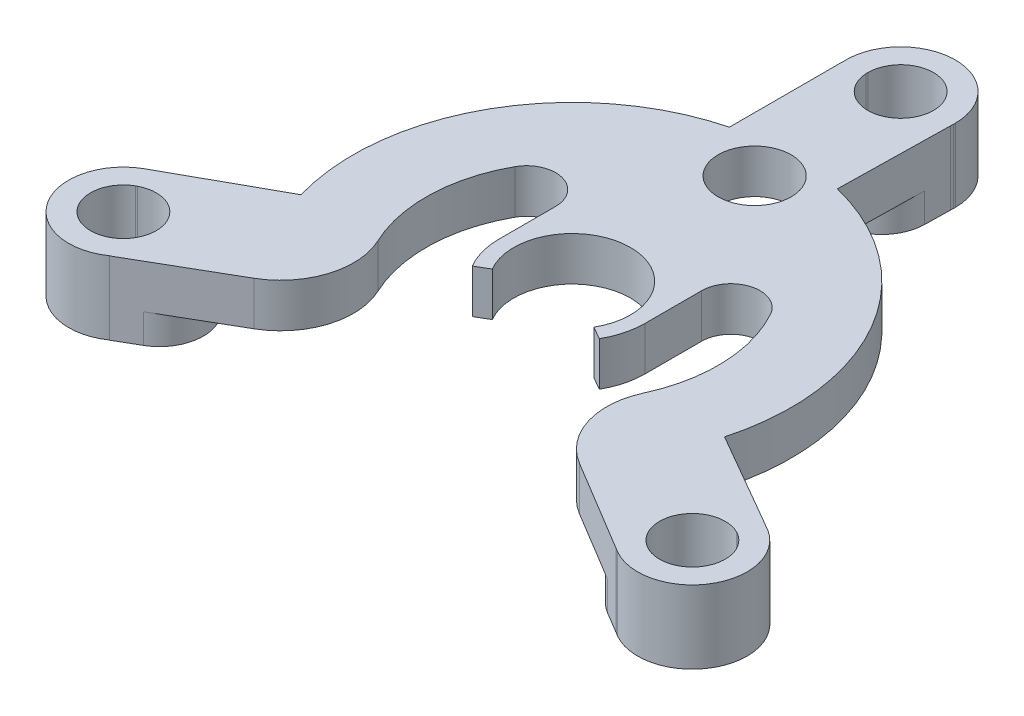
from build123d import *
from build123d.topology import SkipClean

# Parameters (mm, degrees)
EXTRUDE_1_DEPTH     = 5
SKETCH_2_R          = 17.5
CUT_EXTRUDE_1_DEPTH = 2
FILLET_1_R          = 3
EXTRUDE_2_DEPTH     = 3
SKETCH_4_R          = 10
CUT_EXTRUDE_2_DEPTH = 3
FILLET_2_R          = 5
EXTRUDE_3_DEPTH     = 3
FILLET_3_R          = 2
SKETCH_6_R          = 2.5
CUT_EXTRUDE_3_DEPTH = 3


with BuildPart() as part:
    # 草图1 → 凸台-拉伸1 (new body)
    with BuildSketch(Plane(origin=(0, 0, 0), x_dir=(1, 0, 0), z_dir=(0, 1, 0))):
        with BuildLine():
            Line((-17.338032686, -14.340244858), (0.36317955, -4.120445208))
            Line((0.36317955, -4.120445208), (17.341691759, -14.335819716))
            ThreePointArc((17.341691759, -14.335819716), (17.344076322, -14.33293468), (17.346460405, -14.330049246))
            ThreePointArc((17.346460405, -14.330049246), (17.419960834, -14.379816644), (17.494618607, -14.42783043))
            Line((17.494618607, -14.42783043), (17.610571585, -14.497595264))
            ThreePointArc((17.610571585, -14.497595264), (22.80853464, -12.987934561), (21.083416888, -7.857450754))
            ThreePointArc((21.083416888, -7.857450754), (21.085725698, -7.851252881), (21.088032686, -7.845054329))
            Line((21.088032686, -7.845054329), (3.38682045, 2.374745321))
            Line((3.38682045, 2.374745321), (3.744338179, 22.186255466))
            ThreePointArc((3.744338179, 22.186255466), (3.740647382, 22.18687804), (3.736956482, 22.1875))
            ThreePointArc((3.736956482, 22.1875), (3.743306098, 22.276036937), (3.74755837, 22.364699358))
            Line((3.74755837, 22.364699358), (3.75, 22.5))
            ThreePointArc((3.75, 22.5), (-0.156386047, 26.246737702), (-3.736956482, 22.1875))
            ThreePointArc((-3.736956482, 22.1875), (-3.743478403, 22.186400552), (-3.75, 22.185299187))
            Line((-3.75, 22.185299187), (-3.75, 1.745699887))
            Line((-3.75, 1.745699887), (-21.086029938, -7.85043575))
            ThreePointArc((-21.086029938, -7.85043575), (-21.084723704, -7.85394336), (-21.083416888, -7.857450754))
            ThreePointArc((-21.083416888, -7.857450754), (-21.163266932, -7.896220293), (-21.242176977, -7.936868928))
            Line((-21.242176977, -7.936868928), (-21.360571585, -8.002404736))
            ThreePointArc((-21.360571585, -8.002404736), (-22.652148592, -13.258803141), (-17.346460405, -14.330049246))
            ThreePointArc((-17.346460405, -14.330049246), (-17.342247295, -14.335147671), (-17.338032686, -14.340244858))
        make_face()
        with BuildLine():
            ThreePointArc((-18.264550857, -13.139869938), (-18.263724931, -13.141017908), (-18.262898932, -13.142165826))
            Line((-18.262898932, -13.142165826), (-18.360571585, -13.198557159))
            ThreePointArc((-18.360571585, -13.198557159), (-21.434128744, -12.375), (-20.610571585, -9.301442841))
            Line((-20.610571585, -9.301442841), (-20.512898932, -9.245051509))
            ThreePointArc((-20.512898932, -9.245051509), (-20.512317805, -9.246340804), (-20.511736597, -9.247630062))
            ThreePointArc((-20.511736597, -9.247630062), (-17.537014427, -10.125), (-18.264550857, -13.139869938))
        make_face(mode=Mode.SUBTRACT)
        with BuildLine():
            ThreePointArc((20.511736597, -9.247630062), (20.512317805, -9.246340804), (20.512898932, -9.245051509))
            Line((20.512898932, -9.245051509), (20.610571585, -9.301442841))
            ThreePointArc((20.610571585, -9.301442841), (21.434128744, -12.375), (18.360571585, -13.198557159))
            Line((18.360571585, -13.198557159), (18.262898932, -13.142165826))
            ThreePointArc((18.262898932, -13.142165826), (18.263724931, -13.141017908), (18.264550857, -13.139869938))
            ThreePointArc((18.264550857, -13.139869938), (17.537014427, -10.125), (20.511736597, -9.247630062))
        make_face(mode=Mode.SUBTRACT)
        with BuildLine():
            Line((-2.25, 22.387217335), (-2.25, 22.5))
            ThreePointArc((-2.25, 22.5), (0, 24.75), (2.25, 22.5))
            Line((2.25, 22.5), (2.25, 22.387217335))
            ThreePointArc((2.25, 22.387217335), (2.248592874, 22.387358712), (2.24718574, 22.3875))
            ThreePointArc((2.24718574, 22.3875), (0, 20.25), (-2.24718574, 22.3875))
            ThreePointArc((-2.24718574, 22.3875), (-2.248592874, 22.387358712), (-2.25, 22.387217335))
        make_face(mode=Mode.SUBTRACT)
    extrude(amount=EXTRUDE_1_DEPTH)

    # 草图2 → 切除-拉伸1 (cut)
    with BuildSketch(Plane.XZ):
        Circle(SKETCH_2_R)
    extrude(amount=-CUT_EXTRUDE_1_DEPTH, mode=Mode.SUBTRACT)

    # 圆角1
    fillet_1_edges = [part.edges().sort_by_distance(p)[0] for p in [
        (-12.928399103, 1, 11.794341721),
        (12.995206069, 1, 11.720691926),
        (16.678399103, 1, 5.299151193),
        (3.652813923, 1, -17.114524546),
        (-3.75, 1, -17.093492914),
        (-16.648019992, 1, 5.393832621),
    ]]
    fillet(fillet_1_edges, radius=FILLET_1_R)

    # 草图3 → 凸台-拉伸2 (add)
    with BuildSketch(Plane(origin=(0, 5, 0), x_dir=(1, 0, 0), z_dir=(0, 1, 0))):
        with BuildLine():
            Line((9.903270362, -1.38752879), (14.452882373, -4.01424851))
            ThreePointArc((14.452882373, -4.01424851), (14.862591221, -2.025680676), (15, 0))
            ThreePointArc((15, 0), (11.813143266, 9.24389778), (3.606713844, 14.559931842))
            Line((3.606713844, 14.559931842), (3.512924046, 9.362657991))
            ThreePointArc((3.512924046, 9.362657991), (8.219770084, 5.695206737), (10, 0))
            ThreePointArc((10, 0), (9.97578828, -0.695448195), (9.903270362, -1.38752879))
        make_face()
        with BuildLine():
            ThreePointArc((-3.75, 14.523687548), (-13.027173179, 7.435910097), (-14.412627775, -4.156460108))
            Line((-14.412627775, -4.156460108), (-9.86476169, -1.63904753))
            ThreePointArc((-9.86476169, -1.63904753), (-8.723165526, 4.889415425), (-3.75, 9.270248109))
            Line((-3.75, 9.270248109), (-3.75, 14.523687548))
        make_face()
    extrude(amount=-EXTRUDE_2_DEPTH)

    # 草图4 → 切除-拉伸2 (cut)
    with SkipClean():  # the faces are left unmerged after this step: merging them gives an invalid solid
        with BuildSketch(Plane(origin=(0, 5, 0), x_dir=(1, 0, 0), z_dir=(0, 1, 0))):
            Circle(SKETCH_4_R)
        extrude(amount=-CUT_EXTRUDE_2_DEPTH, mode=Mode.SUBTRACT)

    # 圆角2
    fillet_2_edges = [part.edges().sort_by_distance(p)[0] for p in [
        (-6.153270362, 3.5, 7.882719319),
        (6.351837644, 3.5, 7.72361046),
    ]]
    fillet(fillet_2_edges, radius=FILLET_2_R)

    # 草图5 → 凸台-拉伸3 (add)
    with SkipClean():  # the faces are left unmerged after this step: merging them gives an invalid solid
        with BuildSketch(Plane(origin=(0, 5, 0), x_dir=(1, 0, 0), z_dir=(0, 1, 0))):
            with BuildLine():
                Line((-4.318593576, -2.519870934), (-3.454874861, -2.015896748))
                ThreePointArc((-3.454874861, -2.015896748), (-3.861314507, -1.044150506), (-4, 0))
                Line((-4, 0), (-4, 3))
                ThreePointArc((-4, 3), (-4.74341649, 1.58113883), (-5, 0))
                ThreePointArc((-5, 0), (-4.826643134, -1.305188132), (-4.318593576, -2.519870934))
            make_face()
            with BuildLine():
                ThreePointArc((-5, 0), (-4.74341649, 1.58113883), (-4, 3))
                Line((-4, 3), (-4, 9.16515139))
                ThreePointArc((-4, 9.16515139), (-4.507075586, 8.926716623), (-5, 8.660254038))
                Line((-5, 8.660254038), (-5, 0))
            make_face()
            with BuildLine():
                ThreePointArc((-4, 3), (-2.246337039, 4.46698667), (-0.022975456, 4.999947213))
                Line((-0.022975456, 4.999947213), (-0.045950911, 9.999894425))
                ThreePointArc((-0.045950911, 9.999894425), (-2.065581922, 9.784343173), (-4, 9.16515139))
                Line((-4, 9.16515139), (-4, 3))
            make_face()
            with BuildLine():
                ThreePointArc((-4, 0), (-2.834918117, 2.821921202), (-0.018380364, 3.99995777))
                Line((-0.018380364, 3.99995777), (-0.022975456, 4.999947213))
                ThreePointArc((-0.022975456, 4.999947213), (-2.246337039, 4.46698667), (-4, 3))
                Line((-4, 3), (-4, 0))
            make_face()
            with BuildLine():
                Line((-0.045950911, 9.999894425), (-0.022975456, 4.999947213))
                ThreePointArc((-0.022975456, 4.999947213), (2.225787112, 4.477261633), (4, 3))
                Line((4, 3), (4, 9.16515139))
                ThreePointArc((4, 9.16515139), (2.020600167, 9.793731412), (-0.045950911, 9.999894425))
            make_face()
            with BuildLine():
                Line((-0.022975456, 4.999947213), (-0.018380364, 3.99995777))
                ThreePointArc((-0.018380364, 3.99995777), (2.821921202, 2.834918117), (4, 0))
                Line((4, 0), (4, 3))
                ThreePointArc((4, 3), (2.225787112, 4.477261633), (-0.022975456, 4.999947213))
            make_face()
            with BuildLine():
                Line((4, 9.16515139), (4, 3))
                ThreePointArc((4, 3), (4.74341649, 1.58113883), (5, 0))
                Line((5, 0), (5, 8.660254038))
                ThreePointArc((5, 8.660254038), (4.507075586, 8.926716623), (4, 9.16515139))
            make_face()
            with BuildLine():
                ThreePointArc((4, 0), (3.866071708, -1.02639639), (3.473255225, -1.984061023))
                Line((3.473255225, -1.984061023), (4.341569031, -2.480076278))
                ThreePointArc((4.341569031, -2.480076278), (4.832589635, -1.282995488), (5, 0))
                ThreePointArc((5, 0), (4.74341649, 1.58113883), (4, 3))
                Line((4, 3), (4, 0))
            make_face()
        extrude(amount=-EXTRUDE_3_DEPTH)

    # 圆角3
    fillet_3_edges = [part.edges().sort_by_distance(p)[0] for p in [
        (-5, 3.5, -8.660254038),
        (5, 3.5, -8.660254038),
    ]]
    fillet(fillet_3_edges, radius=FILLET_3_R)

    # 草图6 → 切除-拉伸3 (cut)
    with SkipClean():  # the faces are left unmerged after this step: merging them gives an invalid solid
        with BuildSketch(Plane(origin=(0, 5, 0), x_dir=(1, 0, 0), z_dir=(0, 1, 0))):
            with Locations(Location((0, 12.5, 0), (0, 0, 270))):
                Circle(SKETCH_6_R)
        extrude(amount=-CUT_EXTRUDE_3_DEPTH, mode=Mode.SUBTRACT)


solid = part.part
